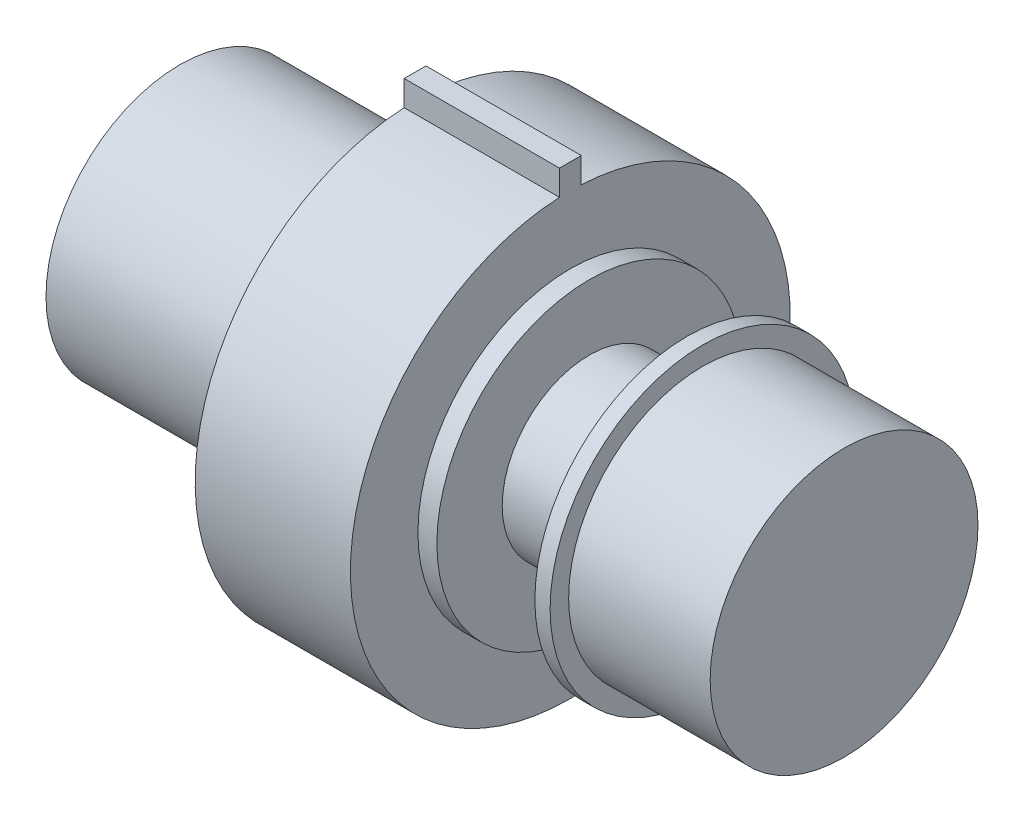
from build123d import *

# Parameters (mm, degrees)
SCHIZZO2_W                   = 10
SCHIZZO2_H                   = 35
ESTRUSIONE_ESTRUSIONE1_DEPTH = 71.3


with BuildPart() as part:
    # Schizzo1 → Rivoluzione1 (revolve)
    with BuildSketch(Plane.XY, mode=Mode.PRIVATE) as rivoluzione1_sk:
        Polygon((-152.5, 0), (152.5, 0), (152.5, 61.5), (87.5, 61.5), (87.5, 70), (80.5, 70), (80.5, 40), (35.5, 40), (35.5, 70), (26.8, 70), (26.8, 101), (-44.5, 101), (-44.5, 61.5), (-152.5, 61.5), align=None)
    revolve(rivoluzione1_sk.sketch.rotate(Axis((-1716.324322208, 0, 0), (1, 0, 0)), 90), axis=Axis((-1716.324322208, 0, 0), (1, 0, 0)))

    # Schizzo2 → Estrusione-Estrusione1 (add)
    with BuildSketch(Plane.ZY.offset(44.5)):
        with Locations((0, 95)):
            Rectangle(SCHIZZO2_W, SCHIZZO2_H)
    extrude(amount=-ESTRUSIONE_ESTRUSIONE1_DEPTH)


solid = part.part
